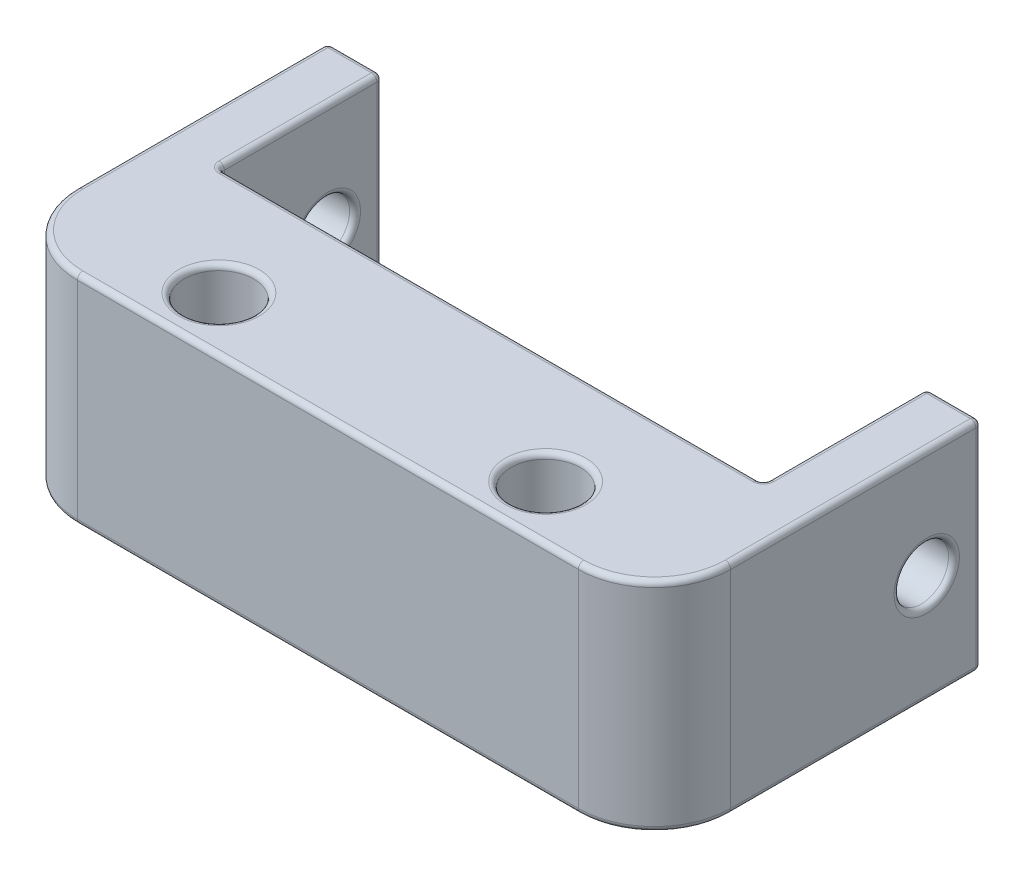
from build123d import *

# Parameters (mm, degrees)
SKETCH1_R           = 3.2
BOSS_EXTRUDE1_DEPTH = 20
SKETCH2_R           = 2.5
CUT_EXTRUDE1_DEPTH  = 70
FILLET1_R           = 0.5


with BuildPart() as part:
    # Sketch1 → Boss-Extrude1 (new body)
    # profile 1 of 2: a face of its own
    with BuildSketch(Plane(origin=(0, 0, 0), x_dir=(1, 0, 0), z_dir=(0, 1, 0))):
        Polygon((25, -5), (-25, -5), (-25, 10), (-30, 10), (-30, -10), (30, -10), (30, 10), (25, 10), align=None)
    # profile 2 of 2: a face of its own
    with BuildSketch(Plane(origin=(0, 0, 0), x_dir=(1, 0, 0), z_dir=(0, 1, 0))):
        with BuildLine():
            Line((-30, -10), (-30, -13))
            ThreePointArc((-30, -13), (-27.949747468, -17.949747468), (-23, -20))
            Line((-23, -20), (23, -20))
            ThreePointArc((23, -20), (27.949747468, -17.949747468), (30, -13))
            Line((30, -13), (30, -10))
            Line((30, -10), (-30, -10))
        make_face()
        with Locations(Location((15, -15, 0), (0, 0, 90))):
            Circle(SKETCH1_R, mode=Mode.SUBTRACT)
        with Locations(Location((-15, -15, 0), (0, 0, 90))):
            Circle(SKETCH1_R, mode=Mode.SUBTRACT)
    extrude(amount=BOSS_EXTRUDE1_DEPTH)

    # Sketch2 → Cut-Extrude1 (cut)
    with BuildSketch(Plane.ZY.offset(30)):
        with Locations((-5, 10)):
            Circle(SKETCH2_R)
    extrude(amount=-CUT_EXTRUDE1_DEPTH, mode=Mode.SUBTRACT)

    # Fillet1
    fillet1_edges = [part.edges().sort_by_distance(p)[0] for p in [
        (-25, 20, -2.5),
        (-15, 0, 18.2),
        (15, 0, 18.2),
        (25, 0, -2.5),
        (27.5, 0, -10),
        (30, 0, 1.5),
        (27.949747468, 0, 17.949747468),
        (-27.5, 20, -10),
        (0, 0, 20),
        (-27.949747468, 0, 17.949747468),
        (-30, 0, 1.5),
        (-27.5, 0, -10),
        (-25, 0, -2.5),
        (0, 0, 5),
        (-30, 20, 1.5),
        (25, 10, 5),
        (25, 10, -10),
        (30, 10, -10),
        (-30, 10, -10),
        (-25, 10, -10),
        (-25, 10, 5),
        (-27.949747468, 20, 17.949747468),
        (0, 20, 20),
        (27.949747468, 20, 17.949747468),
        (-25, 10, -7.5),
        (30, 10, -7.5),
        (25, 10, -7.5),
        (-30, 10, -7.5),
        (30, 20, 1.5),
        (27.5, 20, -10),
        (25, 20, -2.5),
        (15, 20, 18.2),
        (-15, 20, 18.2),
        (0, 20, 5),
    ]]
    fillet(fillet1_edges, radius=FILLET1_R)


solid = part.part
